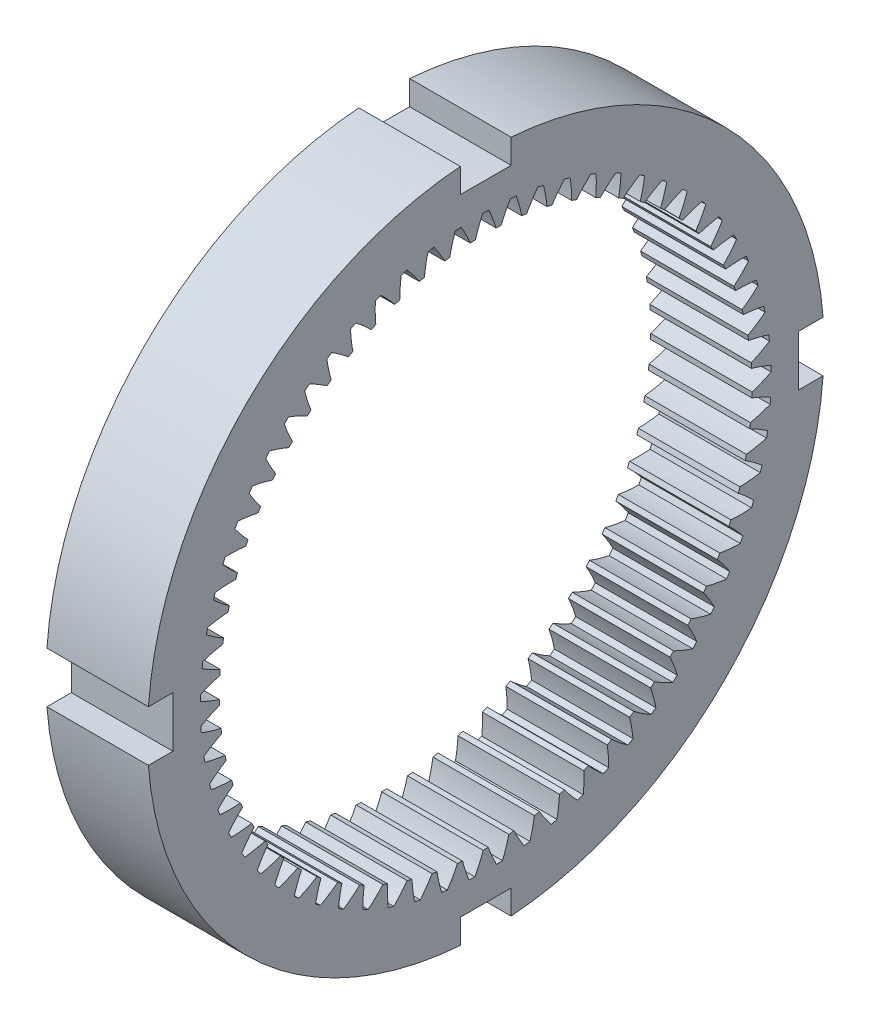
from build123d import *

# Parameters (mm, degrees)
BASPROSKE_W         = 12
BASPROSKE_H         = 3.5
TOOTHCUT_DEPTH      = 51.931326313
TEETHCUTS_COUNT     = 65
TEETHCUTS_ANGLE     = 354.461538462
SKETCH1_R           = 35
BOSS_EXTRUDE1_DEPTH = 12


with BuildPart() as part:
    # BasProSke → Base-Revolve (revolve)
    with BuildSketch(Plane(origin=(0, 0, 0), x_dir=(1, 0, 0), z_dir=(0, 1, 0)), mode=Mode.PRIVATE) as base_revolve_sk:
        with Locations((6, 33.25)):
            Rectangle(BASPROSKE_W, BASPROSKE_H)
    revolve(base_revolve_sk.sketch.rotate(Axis((-10, 0, 0), (1, 0, 0)), 180), axis=Axis((-10, 0, 0), (1, 0, 0)))

    # TooCutSke → ToothCut (cut, through all)
    with BuildSketch(Plane(origin=(0, 0, 0), x_dir=(0, 0, -1), z_dir=(1, 0, 0))):
        with BuildLine():
            ThreePointArc((1.226836811, 31.450680702), (0.831924871, 32.616552546), (0.349894365, 33.749186285))
            ThreePointArc((0.349894365, 33.749186285), (0, 33.751), (-0.349894365, 33.749186285))
            ThreePointArc((-0.349894365, 33.749186285), (-0.831924871, 32.616552546), (-1.226836811, 31.450680702))
            ThreePointArc((-1.226836811, 31.450680702), (0, 31.4746), (1.226836811, 31.450680702))
        make_face()
    toothcut = extrude(amount=TOOTHCUT_DEPTH, mode=Mode.SUBTRACT)

    # TeethCuts: ToothCut ×65 about axis
    teethcuts_axis = Axis((-10, 0, 0), (1, 0, 0))
    for i in range(1, TEETHCUTS_COUNT):
        add(toothcut.rotate(teethcuts_axis, i * TEETHCUTS_ANGLE / (TEETHCUTS_COUNT - 1)), mode=Mode.SUBTRACT)

    # Sketch1 → Boss-Extrude1 (add)
    with BuildSketch(Plane(origin=(12, 0, 0), x_dir=(0, 0, -1), z_dir=(1, 0, 0))):
        with BuildLine():
            Line((39.88734135, 3), (37, 3))
            Line((37, 3), (37, -3))
            Line((37, -3), (39.88734135, -3))
            ThreePointArc((39.88734135, -3), (28.284271247, -28.284271247), (3, -39.88734135))
            Line((3, -39.88734135), (3, -37))
            Line((3, -37), (-3, -37))
            Line((-3, -37), (-3, -39.88734135))
            ThreePointArc((-3, -39.88734135), (-28.284271247, -28.284271247), (-39.88734135, -3))
            Line((-39.88734135, -3), (-37, -3))
            Line((-37, -3), (-37, 3))
            Line((-37, 3), (-39.88734135, 3))
            ThreePointArc((-39.88734135, 3), (-28.284271247, 28.284271247), (-3, 39.88734135))
            Line((-3, 39.88734135), (-3, 37))
            Line((-3, 37), (3, 37))
            Line((3, 37), (3, 39.88734135))
            ThreePointArc((3, 39.88734135), (28.284271247, 28.284271247), (39.88734135, 3))
        make_face()
        Circle(SKETCH1_R, mode=Mode.SUBTRACT)
    extrude(amount=-BOSS_EXTRUDE1_DEPTH)


solid = part.part
